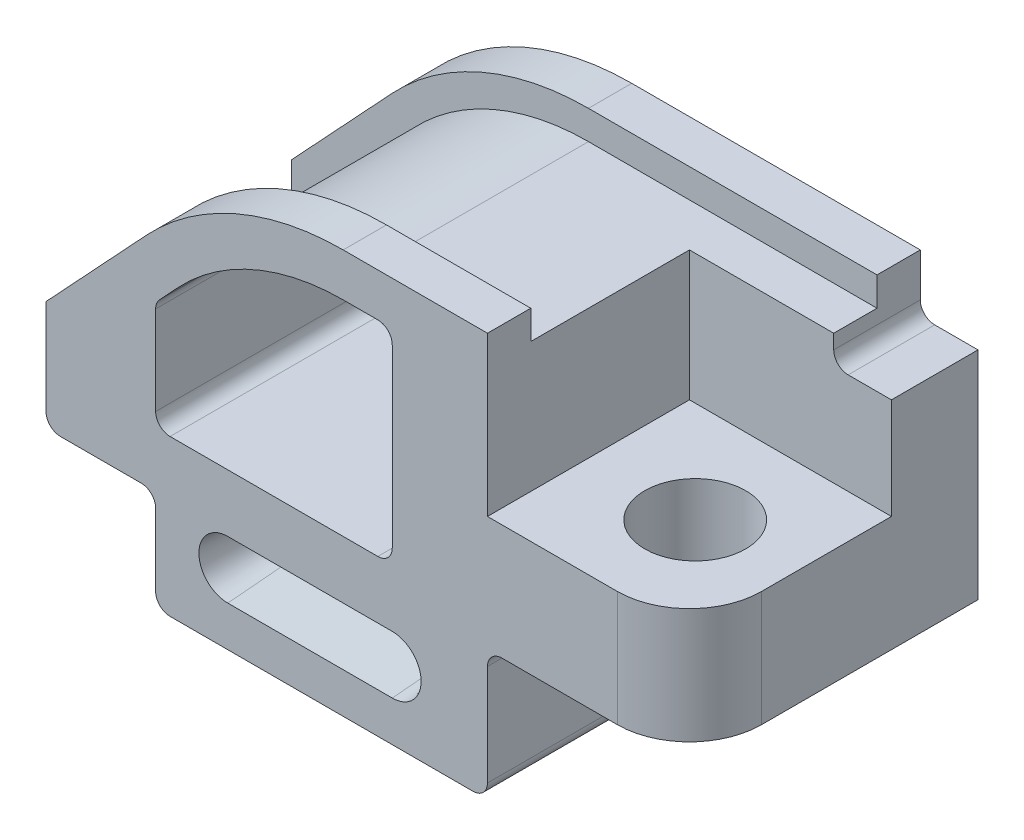
from build123d import *

# Parameters (mm, degrees)
BOSS_EXTRUDE1_DEPTH  = 50
CUT_EXTRUDE1_DEPTH   = 85
CUT_EXTRUDE2_DEPTH   = 35
SKETCH5_W            = 70
SKETCH5_H            = 70
CUT_EXTRUDE3_DEPTH   = 55
SKETCH6_R            = 17.5
CUT_EXTRUDE4_DEPTH   = 244.831909315
FILLET1_R            = 25
FILLET2_R            = 5
FILLET3_R            = 5
CUT_EXTRUDE5_DEPTH   = 25
CUT_EXTRUDE5_DRAFT   = -5
MIRROR1_COPY_1_DEPTH = 25
MIRROR1_COPY_1_DRAFT = -5


with BuildPart() as part:
    # Sketch1 → Boss-Extrude1 (new, symmetric)
    with BuildSketch(Plane.XY):
        with BuildLine():
            Line((0, 0), (38, 0))
            Line((38, 0), (38, -35))
            Line((38, -35), (153, -35))
            Line((153, -35), (153, 10))
            Line((153, 10), (223, 10))
            Line((223, 10), (223, 85))
            Line((223, 85), (203, 85))
            Line((203, 85), (203, 105))
            Line((203, 105), (103, 105))
            ThreePointArc((103, 105), (65.839360074, 97.270575779), (34.84292157, 75.364458857))
            Line((34.84292157, 75.364458857), (0, 38))
            Line((0, 38), (0, 0))
        make_face()
    extrude(amount=BOSS_EXTRUDE1_DEPTH, both=True)

    # Sketch2 → Cut-Extrude1 (cut)
    with BuildSketch(Plane.XY.offset(50)):
        with BuildLine():
            Line((38, 56.755823196), (38, 19))
            Line((38, 19), (120, 19))
            Line((120, 19), (120, 90))
            Line((120, 90), (103, 90))
            ThreePointArc((103, 90), (71.820596108, 83.514674664), (45.813227094, 65.134483456))
            Line((45.813227094, 65.134483456), (38, 56.755823196))
        make_face()
    extrude(amount=-CUT_EXTRUDE1_DEPTH, mode=Mode.SUBTRACT)

    # Sketch4 → Cut-Extrude2 (cut, symmetric)
    with BuildSketch(Plane.XY):
        with BuildLine():
            Line((203, 95), (103, 95))
            ThreePointArc((103, 95), (69.826850763, 88.099975036), (42.156458586, 68.544475257))
            Line((42.156458586, 68.544475257), (0, 23.337208144))
            Line((0, 23.337208144), (0, 38))
            Line((0, 38), (34.84292157, 75.364458857))
            ThreePointArc((34.84292157, 75.364458857), (65.839360074, 97.270575779), (103, 105))
            Line((103, 105), (203, 105))
            Line((203, 105), (203, 95))
        make_face()
    extrude(amount=CUT_EXTRUDE2_DEPTH, both=True, mode=Mode.SUBTRACT)

    # Sketch5 → Cut-Extrude3 (cut)
    with BuildSketch(Plane(origin=(0, 105, 0), x_dir=(1, 0, 0), z_dir=(0, 1, 0))):
        with Locations((188, -15)):
            Rectangle(SKETCH5_W, SKETCH5_H)
    extrude(amount=-CUT_EXTRUDE3_DEPTH, mode=Mode.SUBTRACT)

    # Sketch6 → Cut-Extrude4 (cut, through all)
    with BuildSketch(Plane(origin=(0, 50, 0), x_dir=(1, 0, 0), z_dir=(0, 1, 0))):
        with Locations(Location((190, -15, 0), (0, 0, 270))):
            Circle(SKETCH6_R)
    extrude(amount=-CUT_EXTRUDE4_DEPTH, mode=Mode.SUBTRACT)

    # Fillet1
    fillet1_edges = [part.edges().sort_by_distance(p)[0] for p in [
        (223, 30, 50),
    ]]
    fillet(fillet1_edges, radius=FILLET1_R)

    # Fillet2
    fillet2_edges = [part.edges().sort_by_distance(p)[0] for p in [
        (153, 10, 0),
        (153, -35, 0),
        (38, -35, 0),
        (38, 0, 0),
        (0, 0, 0),
        (203, 85, -35),
    ]]
    fillet(fillet2_edges, radius=FILLET2_R)

    # Fillet3
    fillet3_edges = [part.edges().sort_by_distance(p)[0] for p in [
        (120, 90, 7.5),
        (120, 19, 7.5),
        (38, 19, 7.5),
        (38, 56.755823196, 7.5),
    ]]
    fillet(fillet3_edges, radius=FILLET3_R)


with BuildPart() as cut_extrude5_tool:
    # Sketch7 → Cut-Extrude5 (with draft: the straight prism first)
    with BuildSketch(Plane.XY.offset(50)):
        with BuildLine():
            ThreePointArc((63, -1), (53, -11), (63, -21))
            Line((63, -21), (120, -21))
            ThreePointArc((120, -21), (130, -11), (120, -1))
            Line((120, -1), (63, -1))
        make_face()
    extrude(amount=-CUT_EXTRUDE5_DEPTH)
    # Cut-Extrude5: the draft: its side faces are tilted about the plane it starts from
    cut_extrude5_sides = [cut_extrude5_tool.faces().sort_by_distance(p)[0] for p in [
        (130, -11, 37.5),
        (91.5, -1, 37.5),
        (53, -11, 37.5),
        (91.5, -21, 37.5),
    ]]
    draft(cut_extrude5_sides, Plane.XY.offset(50), CUT_EXTRUDE5_DRAFT)


with BuildPart() as part_1:
    add(part.part)

    # Cut-Extrude5: cut by cut_extrude5_tool
    add(cut_extrude5_tool.part, mode=Mode.SUBTRACT)


with BuildPart() as mirror1_copy_1_tool:
    # Mirror1 copy 1 sketch → Mirror1 copy 1 (with draft: the straight prism first)
    with BuildSketch(Plane(origin=(0, 0, -50), x_dir=(1, 0, 0), z_dir=(0, 0, -1))):
        with BuildLine():
            ThreePointArc((63, 1), (53, 11), (63, 21))
            Line((63, 21), (120, 21))
            ThreePointArc((120, 21), (130, 11), (120, 1))
            Line((120, 1), (63, 1))
        make_face()
    extrude(amount=-MIRROR1_COPY_1_DEPTH)
    # Mirror1 copy 1: the draft: its side faces are tilted about the plane it starts from
    mirror1_copy_1_sides = [mirror1_copy_1_tool.faces().sort_by_distance(p)[0] for p in [
        (130, -11, -37.5),
        (91.5, -1, -37.5),
        (53, -11, -37.5),
        (91.5, -21, -37.5),
    ]]
    draft(mirror1_copy_1_sides, Plane(origin=(0, 0, -50), x_dir=(1, 0, 0), z_dir=(0, 0, -1)), MIRROR1_COPY_1_DRAFT)


with BuildPart() as part_2:
    add(part_1.part)

    # Mirror1 copy 1: cut by mirror1_copy_1_tool
    add(mirror1_copy_1_tool.part, mode=Mode.SUBTRACT)


solid = part_2.part
